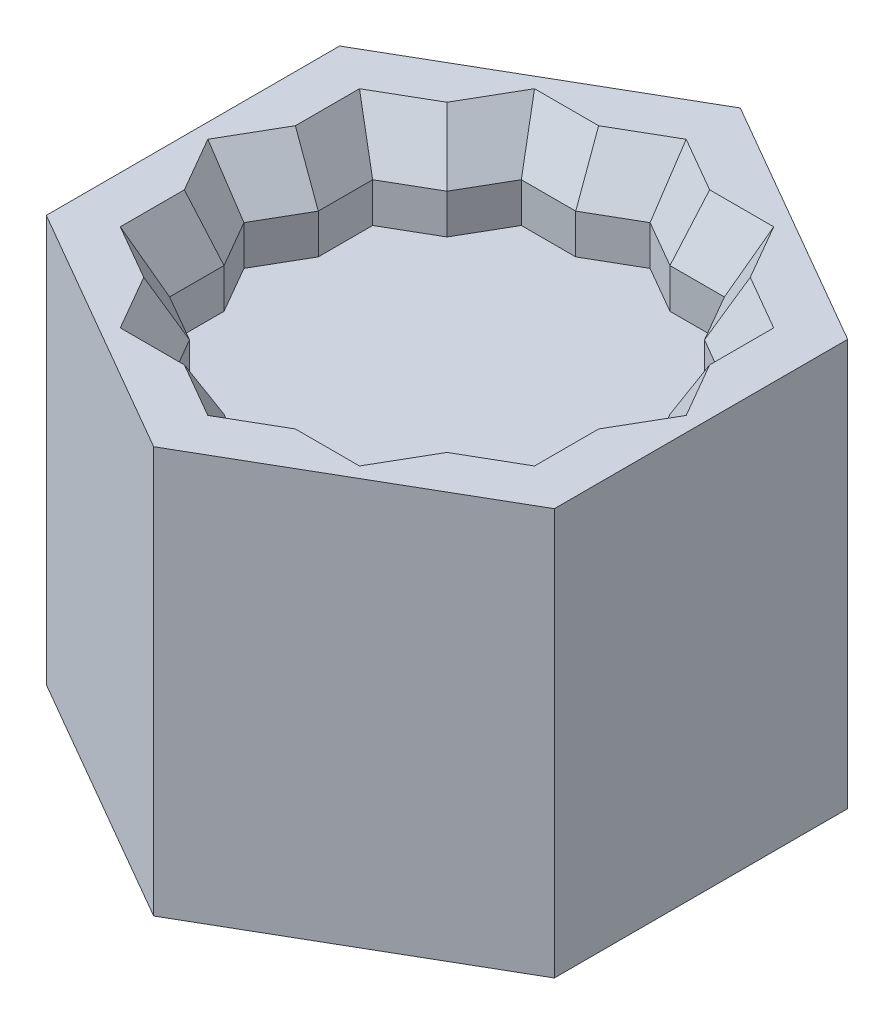
from build123d import *

# Parameters (mm, degrees)
BOSS_EXTRUDE1_DEPTH = 6
BOSS_EXTRUDE4_DEPTH = 20
CUT_EXTRUDE2_DEPTH  = 15
CUT_EXTRUDE3_DEPTH  = 6
CHAMFER2_SIZE       = 2
CHAMFER2_SIZE2      = 3.464101615


with BuildPart() as part:
    # Sketch1 → Boss-Extrude1 (new body)
    with BuildSketch(Plane(origin=(0, 0, 0), x_dir=(1, 0, 0), z_dir=(0, 1, 0))):
        Polygon((16.25, 9.381941874), (0, 18.763883749), (-16.25, 9.381941874), (-16.25, -9.381941874), (0, -18.763883749), (16.25, -9.381941874), align=None)
        Polygon((11.25, 6.495190528), (0, 12.990381057), (-11.25, 6.495190528), (-11.25, -6.495190528), (0, -12.990381057), (11.25, -6.495190528), align=None, mode=Mode.SUBTRACT)
    extrude(amount=BOSS_EXTRUDE1_DEPTH)

    # Sketch5 → Boss-Extrude4 (add)
    with BuildSketch(Plane.XZ):
        Polygon((16.25, 9.381941874), (0, 18.763883749), (-16.25, 9.381941874), (-16.25, -9.381941874), (0, -18.763883749), (16.25, -9.381941874), align=None)
    extrude(amount=BOSS_EXTRUDE4_DEPTH)

    # Sketch6 → Cut-Extrude2 (cut)
    with BuildSketch(Plane.XZ.offset(20)):
        with BuildLine():
            Line((-2.618090908, 1.66), (-2.618090908, -1.66))
            ThreePointArc((-2.618090908, -1.66), (3.1, 0), (-2.618090908, 1.66))
        make_face()
    extrude(amount=-CUT_EXTRUDE2_DEPTH, mode=Mode.SUBTRACT)

    # Sketch7 → Cut-Extrude3 (cut)
    with BuildSketch(Plane(origin=(0, 6, 0), x_dir=(1, 0, 0), z_dir=(0, 1, 0))):
        Polygon((-6.495190528, 11.25), (-12.990381057, 0), (-6.495190528, -11.25), (6.495190528, -11.25), (12.990381057, 0), (6.495190528, 11.25), align=None)
    extrude(amount=-CUT_EXTRUDE3_DEPTH, mode=Mode.SUBTRACT)

    # Chamfer2
    chamfer2_edges = [part.edges().sort_by_distance(p)[0] for p in [
        (4.754809472, 6, 11.25),
        (7.365381057, 6, 9.742785793),
        (11.25, 6, 4.754809472),
        (9.742785793, 6, -7.365381057),
        (-1.507214207, 6, -12.120190528),
        (-11.25, 6, -4.754809472),
        (-9.742785793, 6, 7.365381057),
        (1.507214207, 6, 12.120190528),
        (9.742785793, 6, 7.365381057),
        (-1.507214207, 6, 12.120190528),
        (-11.25, 6, 4.754809472),
        (-9.742785793, 6, -7.365381057),
        (1.507214207, 6, -12.120190528),
        (11.25, 6, -4.754809472),
        (12.120190528, 6, 1.507214207),
        (12.120190528, 6, -1.507214207),
        (7.365381057, 6, -9.742785793),
        (4.754809472, 6, -11.25),
        (-4.754809472, 6, -11.25),
        (-7.365381057, 6, -9.742785793),
        (-12.120190528, 6, -1.507214207),
        (-12.120190528, 6, 1.507214207),
        (-7.365381057, 6, 9.742785793),
        (-4.754809472, 6, 11.25),
    ]]
    chamfer2_side = [part.faces().sort_by_distance(p)[0] for p in [
        (7.87677715, 6, -13.642978223),
    ]]
    chamfer(chamfer2_edges, length=CHAMFER2_SIZE, length2=CHAMFER2_SIZE2, reference=chamfer2_side[0])


solid = part.part
